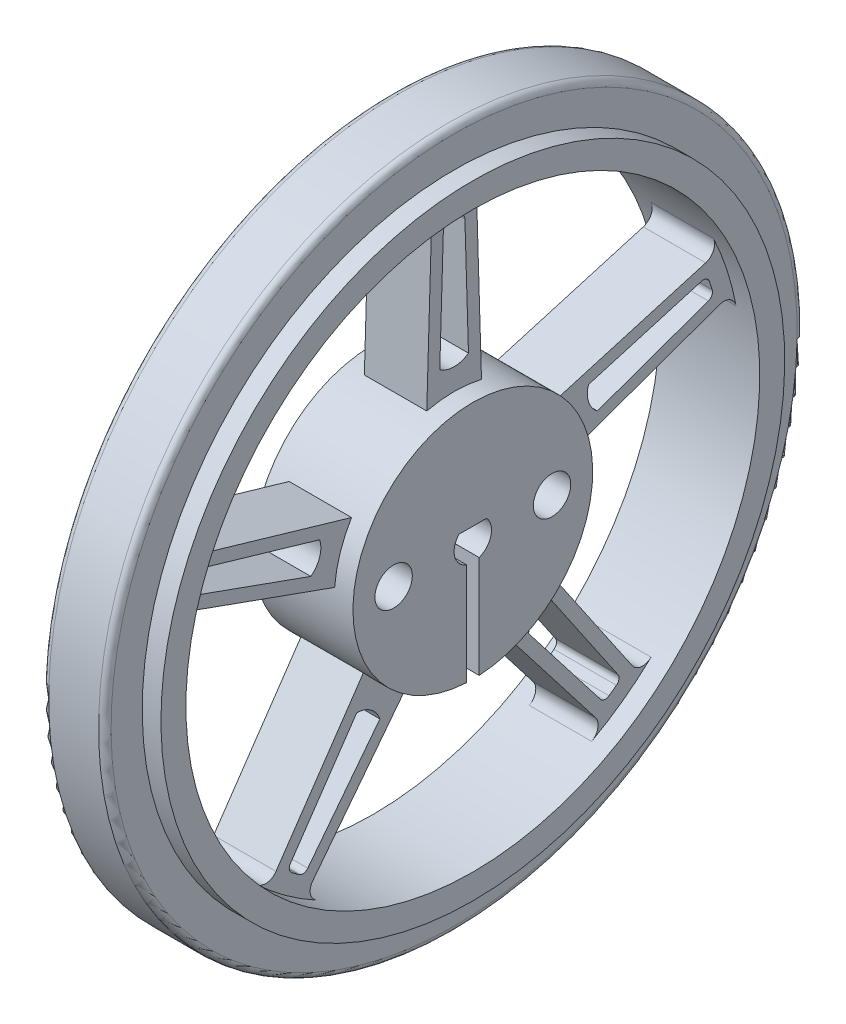
from build123d import *

# Parameters (mm, degrees)
SKETCH2_W                       = 8
SKETCH2_H                       = 2
BOSS_EXTRUDE1_REACH             = 42.128
SKETCH3_R                       = 1.5
BOSS_EXTRUDE1_DIRECTION_2_REACH = 42.128
BOSS_EXTRUDE2_DEPTH             = 5
FILLET1_R                       = 1
FILLET2_R                       = 1
CIRPATTERN1_COUNT               = 5
FILLET1_OF_CIRPATTERN1_R        = 1
FILLET2_OF_CIRPATTERN1_R        = 1
BOSS_EXTRUDE3_START             = 3
BOSS_EXTRUDE3_DEPTH             = 3
FILLET3_R                       = 0.5


with BuildPart() as part:
    # Sketch2 → Revolve1 (revolve)
    with BuildSketch(Plane.XY):
        with Locations((0, -24)):
            Rectangle(SKETCH2_W, SKETCH2_H)
        with BuildLine():
            Line((2.5, -25), (-2.5, -25))
            Line((-2.5, -25), (-2.5, -27.5))
            ThreePointArc((-2.5, -27.5), (-2.353553391, -27.853553391), (-2, -28))
            Line((-2, -28), (2, -28))
            ThreePointArc((2, -28), (2.353553391, -27.853553391), (2.5, -27.5))
            Line((2.5, -27.5), (2.5, -25))
        make_face()
    revolve(axis=Axis((-65.527863449, 0, 0), (1, 0, 0)))


with BuildPart() as body_2:

    # Boss-Extrude1: up to this face of the body (flat: up to its plane)
    boss_extrude1_end = Plane(part.part.faces().sort_by_distance((4, 24.292893219, 0))[0])
    # Sketch3 → Boss-Extrude1 (new, up to the picked face)
    with BuildSketch(Plane.ZY.offset(2.5), mode=Mode.PRIVATE) as boss_extrude1_sk1:
        with BuildLine():
            Line((-1.109469632, 1.009493505), (1.109469632, 1.009493505))
            ThreePointArc((1.109469632, 1.009493505), (1.455460496, -0.362815028), (0.505806645, -1.412147173))
            Line((0.505806645, -1.412147173), (0.505806645, -9.597975753))
            ThreePointArc((0.505806645, -9.597975753), (0, 9.611294342), (-0.505806645, -9.597975753))
            Line((-0.505806645, -9.597975753), (-0.505806645, -1.412147173))
            ThreePointArc((-0.505806645, -1.412147173), (-1.455460496, -0.362815028), (-1.109469632, 1.009493505))
        make_face()
        with Locations(Location((6.35, 0, 0), (0, 0, 90))):
            Circle(SKETCH3_R, mode=Mode.SUBTRACT)
        with Locations(Location((-6.35, 0, 0), (0, 0, 90))):
            Circle(SKETCH3_R, mode=Mode.SUBTRACT)
    boss_extrude1_tool1 = split(extrude(boss_extrude1_sk1.sketch, amount=-BOSS_EXTRUDE1_REACH, mode=Mode.PRIVATE), bisect_by=boss_extrude1_end, keep=Keep.BOTH, mode=Mode.PRIVATE)
    add(boss_extrude1_tool1.solids().sort_by(Axis((-2.5, 1.281248, 0), (1, 0, 0)))[0])


    # Boss-Extrude1 direction 2: up to this face of the body (flat: up to its plane)
    boss_extrude1_direction_2_end = Plane(part.part.faces().sort_by_distance((-4, 23.707106781, 0))[0])
    # Sketch3 → Boss-Extrude1 direction 2 (add, up to the picked face)
    with BuildSketch(Plane.ZY.offset(2.5), mode=Mode.PRIVATE) as boss_extrude1_direction_2_sk1:
        with BuildLine():
            Line((-1.109469632, 1.009493505), (1.109469632, 1.009493505))
            ThreePointArc((1.109469632, 1.009493505), (1.455460496, -0.362815028), (0.505806645, -1.412147173))
            Line((0.505806645, -1.412147173), (0.505806645, -9.597975753))
            ThreePointArc((0.505806645, -9.597975753), (0, 9.611294342), (-0.505806645, -9.597975753))
            Line((-0.505806645, -9.597975753), (-0.505806645, -1.412147173))
            ThreePointArc((-0.505806645, -1.412147173), (-1.455460496, -0.362815028), (-1.109469632, 1.009493505))
        make_face()
        with Locations(Location((6.35, 0, 0), (0, 0, 90))):
            Circle(SKETCH3_R, mode=Mode.SUBTRACT)
        with Locations(Location((-6.35, 0, 0), (0, 0, 90))):
            Circle(SKETCH3_R, mode=Mode.SUBTRACT)
    boss_extrude1_direction_2_tool1 = split(extrude(boss_extrude1_direction_2_sk1.sketch, amount=BOSS_EXTRUDE1_DIRECTION_2_REACH, mode=Mode.PRIVATE), bisect_by=boss_extrude1_direction_2_end, keep=Keep.BOTH, mode=Mode.PRIVATE)
    add(boss_extrude1_direction_2_tool1.solids().sort_by(Axis((-2.5, 1.281248, 0), (-1, 0, 0)))[0])


with BuildPart() as part_1:
    add(part.part)

    add(body_2.part)  # Boss-Extrude2 merges body 2
    # Sketch4 → Boss-Extrude2 (add)
    with BuildSketch(Plane.ZY.offset(2.5)):
        with BuildLine():
            Line((2.193830501, 9.357568416), (1.783681385, 22.930732232))
            ThreePointArc((1.783681385, 22.930732232), (0, 23), (-1.783681385, 22.930732232))
            Line((-1.783681385, 22.930732232), (-2.193830501, 9.357568416))
            ThreePointArc((-2.193830501, 9.357568416), (0, 9.611294342), (2.193830501, 9.357568416))
        make_face()
        with BuildLine():
            ThreePointArc((-1.15, 11.702139555), (0, 11.332236709), (1.15, 11.702139555))
            Line((1.15, 11.702139555), (0.86465248, 21.14521399))
            ThreePointArc((0.86465248, 21.14521399), (0.713053714, 21.488965069), (0.364880601, 21.630112058))
            Line((0.364880601, 21.630112058), (-0.364880601, 21.630112058))
            ThreePointArc((-0.364880601, 21.630112058), (-0.713053714, 21.488965069), (-0.86465248, 21.14521399))
            Line((-0.86465248, 21.14521399), (-1.15, 11.702139555))
        make_face(mode=Mode.SUBTRACT)
    boss_extrude2 = extrude(amount=-BOSS_EXTRUDE2_DEPTH)

    # Fillet1
    fillet1_edges = [part_1.edges().sort_by_distance(p)[0] for p in [
        (0, 22.930732232, 1.783681385),
    ]]
    fillet(fillet1_edges, radius=FILLET1_R)

    # Fillet2
    fillet2_edges = [part_1.edges().sort_by_distance(p)[0] for p in [
        (0, 22.930732232, -1.783681385),
    ]]
    fillet(fillet2_edges, radius=FILLET2_R)

    # CirPattern1: Boss-Extrude2 ×5 about axis
    cirpattern1_axis = Axis((0, 0, 0), (1, 0, 0))
    for i in range(1, CIRPATTERN1_COUNT):
        add(boss_extrude2.rotate(cirpattern1_axis, i * 360 / CIRPATTERN1_COUNT))

    # Fillet1 of CirPattern1
    fillet1_of_cirpattern1_edges = [part_1.edges().sort_by_distance(p)[0] for p in [
        (0, 5.389604149, 22.359610174),
        (0, -19.599773683, 12.035317677),
        (0, -17.502930456, -14.921374784),
        (0, 8.782367758, -21.257234453),
    ]]
    fillet(fillet1_of_cirpattern1_edges, radius=FILLET1_OF_CIRPATTERN1_R)

    # Fillet2 of CirPattern1
    fillet2_of_cirpattern1_edges = [part_1.edges().sort_by_distance(p)[0] for p in [
        (0, 8.782367758, 21.257234453),
        (0, -17.502930456, 14.921374784),
        (0, -19.599773683, -12.035317677),
        (0, 5.389604149, -22.359610174),
    ]]
    fillet(fillet2_of_cirpattern1_edges, radius=FILLET2_OF_CIRPATTERN1_R)

    # Sketch5 → Boss-Extrude3 (add)
    with BuildSketch(Plane.ZY.offset(4).offset(BOSS_EXTRUDE3_START)):
        with BuildLine():
            Line((-1.109469632, 1.009493505), (1.109469632, 1.009493505))
            ThreePointArc((1.109469632, 1.009493505), (1.455460496, -0.362815028), (0.505806645, -1.412147173))
            Line((0.505806645, -1.412147173), (0.505806645, -3.463258529))
            ThreePointArc((0.505806645, -3.463258529), (0, 3.5), (-0.505806645, -3.463258529))
            Line((-0.505806645, -3.463258529), (-0.505806645, -1.412147173))
            ThreePointArc((-0.505806645, -1.412147173), (-1.455460496, -0.362815028), (-1.109469632, 1.009493505))
        make_face()
    extrude(amount=-BOSS_EXTRUDE3_DEPTH)

    # Fillet3
    fillet3_edges = [part_1.edges().sort_by_distance(p)[0] for p in [
        (-7, 3.5, 0),
    ]]
    fillet(fillet3_edges, radius=FILLET3_R)


solid = part_1.part
